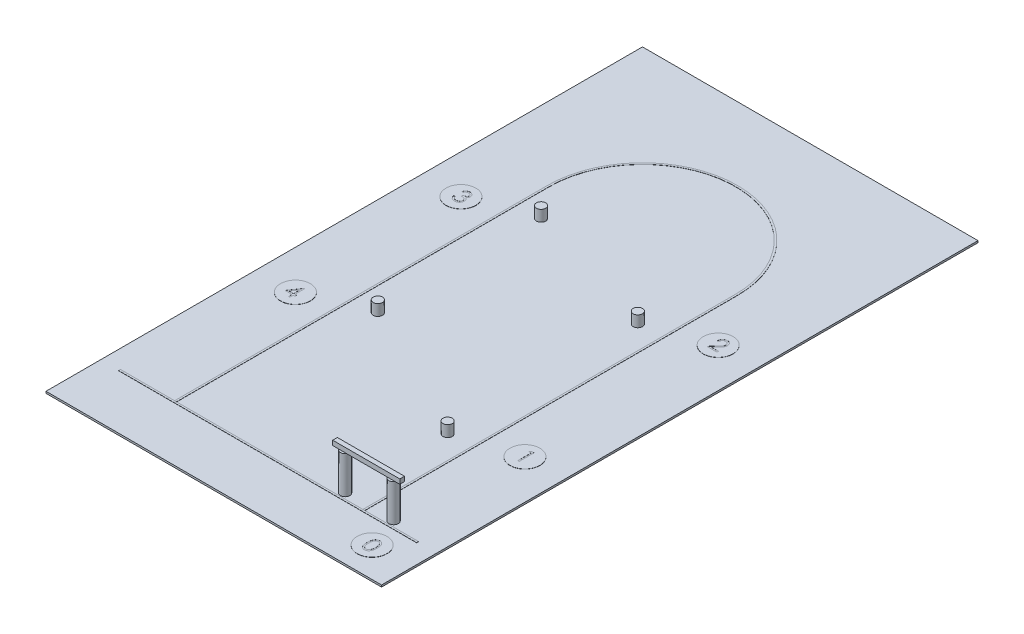
from build123d import *

# Parameters (mm, degrees)
EXTRUDE_1_DEPTH     = 1
SKETCH_2_W          = 1800
SKETCH_2_H          = 3200
EXTRUDE_1_2_DEPTH   = 10
SKETCH_3_W          = 1598.63222264
SKETCH_3_H          = 10
EXTRUDE_2_DEPTH     = 1
SKETCH_4_R          = 80
EXTRUDE_2_2_DEPTH   = 1
EXTRUDE_2_2_2_DEPTH = 1
EXTRUDE_2_2_3_DEPTH = 1
EXTRUDE_2_2_4_DEPTH = 1
EXTRUDE_2_2_5_DEPTH = 1
CUT_EXTRUDE_1_DEPTH = 0.5
SKETCH_6_R          = 25
EXTRUDE_3_DEPTH     = 60
EXTRUDE_3_2_DEPTH   = 60
EXTRUDE_3_3_DEPTH   = 60
EXTRUDE_3_4_DEPTH   = 60
SKETCH_8_R          = 24.990921926
EXTRUDE_5_DEPTH     = 200
SKETCH_8_R_2        = 25.210760771
EXTRUDE_5_2_DEPTH   = 200
SKETCH_7_W          = 360
SKETCH_7_H          = 25
EXTRUDE_4_DEPTH     = 25


with BuildPart() as part:
    # 草圖1 → Extrude 1 (new body)
    with BuildSketch(Plane(origin=(0, 0, 0), x_dir=(1, 0, 0), z_dir=(0, 1, 0))):
        with BuildLine():
            Line((500, 0), (500, 2000))
            ThreePointArc((500, 2000), (0, 2500), (-500, 2000))
            Line((-500, 2000), (-500, 0))
            Line((-500, 0), (-510, 0))
            Line((-510, 0), (-510, 2000))
            ThreePointArc((-510, 2000), (0, 2510), (510, 2000))
            Line((510, 2000), (510, 0))
            Line((510, 0), (500, 0))
        make_face()
    extrude(amount=EXTRUDE_1_DEPTH)


with BuildPart() as body_2:
    # 草圖2 → Extrude 1 2 (new body)
    with BuildSketch(Plane(origin=(0, 0, 0), x_dir=(-1, 0, 0), z_dir=(0, -1, 0))):
        with Locations((0, 1300)):
            Rectangle(SKETCH_2_W, SKETCH_2_H)
    extrude(amount=EXTRUDE_1_2_DEPTH)


with BuildPart() as body_3:
    # 草圖3 → Extrude 2 (new body)
    with BuildSketch(Plane(origin=(0, 0, 0), x_dir=(1, 0, 0), z_dir=(0, 1, 0))):
        with Locations((-0.966338607, -5)):
            Rectangle(SKETCH_3_W, SKETCH_3_H)
    extrude(amount=EXTRUDE_2_DEPTH)


with BuildPart() as body_4:
    # 草圖4 → Extrude 2 2 (new body)
    with BuildSketch(Plane(origin=(0, 0, 0), x_dir=(1, 0, 0), z_dir=(0, 1, 0))):
        with Locations(Location((690, 679.319013419, 0), (0, 0, 270))):
            Circle(SKETCH_4_R)
    extrude(amount=EXTRUDE_2_2_DEPTH)


with BuildPart() as body_5:
    # 草圖4 → Extrude 2 2 2 (new body)
    with BuildSketch(Plane(origin=(0, 0, 0), x_dir=(1, 0, 0), z_dir=(0, 1, 0))):
        with Locations(Location((690, 1716, 0), (0, 0, 270))):
            Circle(SKETCH_4_R)
    extrude(amount=EXTRUDE_2_2_2_DEPTH)


with BuildPart() as body_6:
    # 草圖4 → Extrude 2 2 3 (new body)
    with BuildSketch(Plane(origin=(0, 0, 0), x_dir=(1, 0, 0), z_dir=(0, 1, 0))):
        with Locations(Location((-690, 1716, 0), (0, 0, 270))):
            Circle(SKETCH_4_R)
    extrude(amount=EXTRUDE_2_2_3_DEPTH)


with BuildPart() as body_7:
    # 草圖4 → Extrude 2 2 4 (new body)
    with BuildSketch(Plane(origin=(0, 0, 0), x_dir=(1, 0, 0), z_dir=(0, 1, 0))):
        with Locations(Location((-690, 828, 0), (0, 0, 270))):
            Circle(SKETCH_4_R)
    extrude(amount=EXTRUDE_2_2_4_DEPTH)


with BuildPart() as body_8:
    # 草圖4 → Extrude 2 2 5 (new body)
    with BuildSketch(Plane(origin=(0, 0, 0), x_dir=(1, 0, 0), z_dir=(0, 1, 0))):
        with Locations(Location((690, -140.508642241, 0), (0, 0, 270))):
            Circle(SKETCH_4_R)
    extrude(amount=EXTRUDE_2_2_5_DEPTH)


with BuildPart() as cut_extrude_1_tool:
    # 草圖5 → 除料-伸長1 (new body)
    # profile 1 of 5: a face of its own
    with BuildSketch(Plane(origin=(0, 1, 0), x_dir=(1, 0, 0), z_dir=(0, 1, 0))):
        Polygon((681.571564463, 721.808809917), (696.247671234, 721.808809917), (696.247671234, 642.433809917), (689.124273798, 642.433809917), (689.124273798, 713.667784276), (676.912735336, 713.667784276), align=None)
    # profile 2 of 5: a face of its own
    with BuildSketch(Plane(origin=(0, 1, 0), x_dir=(1, 0, 0), z_dir=(0, 1, 0))):
        with BuildLine():
            Line((674.877478926, 1735.520309108), (667.75408149, 1735.520309108))
            add(Edge.make_bspline(
                [(667.75408149, 1735.520309108), (667.800507996, 1736.465345313), (667.891688417, 1738.321371268), (668.31868712, 1741.027467003), (668.929667728, 1743.614066902), (669.793527489, 1746.060402451), (670.866366288, 1748.388103972), (672.152922266, 1750.587925757), (673.676782805, 1752.651475929), (675.405042666, 1754.559624697), (677.282117159, 1756.310128535), (679.307448286, 1757.82177422), (681.435719441, 1759.098978552), (683.660473667, 1760.166713858), (686.006811448, 1760.968171078), (688.453440546, 1761.562840405), (691.011110246, 1761.920625388), (692.753732175, 1761.959083383), (693.639998958, 1761.978642441)],
                knots=[0, 0, 0, 0, 1.10065271, 2.161652631, 3.183658789, 4.190468796, 5.17591951, 6.163126047, 7.15150782, 8.156236427, 9.156009102, 10.134482811, 11.092018607, 12.041330605, 13.001268258, 13.972401359, 14.968799086, 16, 16, 16, 16], degree=3))
            add(Edge.make_bspline(
                [(693.639998958, 1761.978642441), (694.510358852, 1761.958266733), (696.220584954, 1761.918229193), (698.716634211, 1761.574398708), (701.092833567, 1761.035882612), (703.344538272, 1760.280336563), (705.453782951, 1759.264689728), (707.436412711, 1758.044638404), (709.316031099, 1756.633581514), (711.00800637, 1754.972289674), (712.561671739, 1753.198771312), (713.902026454, 1751.305384926), (715.049860697, 1749.349827911), (716.006617008, 1747.317188339), (716.710925873, 1745.188327516), (717.245645948, 1742.994239167), (717.547892652, 1740.712212203), (717.594279935, 1739.167652816), (717.617863541, 1738.382388435)],
                knots=[0, 0, 0, 0, 1.111607364, 2.184268762, 3.212621178, 4.221274766, 5.211760367, 6.196651075, 7.1921475, 8.207485113, 9.220403448, 10.201281604, 11.166441695, 12.114753415, 13.065576456, 14.026450734, 14.996634279, 16, 16, 16, 16], degree=3))
            add(Edge.make_bspline(
                [(717.617863541, 1738.382388435), (717.579462759, 1737.276857186), (717.503335073, 1735.085195198), (716.852134033, 1731.864500989), (715.835079227, 1728.744078806), (714.610496313, 1726.232714991), (713.3751391, 1724.209026829), (712.261904552, 1722.542861557), (710.958684731, 1720.748862541), (709.446511652, 1718.833037212), (707.756666159, 1716.780379185), (705.873842097, 1714.592128468), (703.78461313, 1712.290893688), (702.318250702, 1710.719141657), (701.558418429, 1709.904699132)],
                knots=[0, 0, 0, 0, 1.184426356, 2.348067706, 3.509069118, 4.696110526, 5.333549288, 6.050745305, 6.844228056, 7.710549037, 8.667450064, 9.695053472, 10.805634456, 12, 12, 12, 12], degree=3))
            Line((701.558418429, 1709.904699132), (681.698767988, 1688.709411672))
            Line((681.698767988, 1688.709411672), (718.635491746, 1688.709411672))
            Line((718.635491746, 1688.709411672), (718.635491746, 1680.568386031))
            Line((718.635491746, 1680.568386031), (664.701196875, 1680.568386031))
            Line((664.701196875, 1680.568386031), (695.48445008, 1713.418696528))
            add(Edge.make_bspline(
                [(695.48445008, 1713.418696528), (696.233928941, 1714.201068837), (697.673524449, 1715.703845926), (699.70966503, 1717.897838058), (701.538442087, 1719.933229428), (703.171693673, 1721.806174366), (704.573989241, 1723.54406885), (705.818413073, 1725.090627306), (706.815489868, 1726.51380859), (707.897606877, 1728.163461799), (708.945673955, 1730.177598277), (709.846293459, 1732.638987302), (710.395451629, 1735.172801782), (710.461329148, 1736.885080122), (710.494466105, 1737.746370807)],
                knots=[0, 0, 0, 0, 1.329631726, 2.553950428, 3.673215718, 4.687767853, 5.603093632, 6.413772471, 7.123043292, 7.734684054, 8.834405432, 9.900288307, 10.943827018, 12, 12, 12, 12], degree=3))
            add(Edge.make_bspline(
                [(710.494466105, 1737.746370807), (710.480048378, 1738.287966806), (710.451633807, 1739.35534852), (710.200861024, 1740.920300555), (709.821890618, 1742.429895439), (709.278846373, 1743.888776623), (708.56205066, 1745.282276232), (707.689529366, 1746.612090516), (706.682826142, 1747.897715262), (705.518252712, 1749.103156129), (704.238920031, 1750.207176324), (702.887407585, 1751.185168976), (701.457521292, 1752.002484524), (699.95528995, 1752.672488835), (698.384901626, 1753.198073373), (696.743319013, 1753.562259014), (695.03507793, 1753.790915346), (693.868639724, 1753.821852816), (693.274288822, 1753.8376168)],
                knots=[0, 0, 0, 0, 0.991446411, 1.95395049, 2.89581595, 3.838931463, 4.798493298, 5.75982156, 6.748411868, 7.785213223, 8.824556874, 9.840280684, 10.836137867, 11.835679398, 12.848801643, 13.863922112, 14.911575587, 16, 16, 16, 16], degree=3))
            add(Edge.make_bspline(
                [(693.274288822, 1753.8376168), (692.653557436, 1753.82140089), (691.434543486, 1753.78955552), (689.64477256, 1753.566791533), (687.937398677, 1753.182484081), (686.30812695, 1752.656870215), (684.754200629, 1751.988792412), (683.283176773, 1751.156676059), (681.898357677, 1750.163728982), (680.597140094, 1749.03795208), (679.398260569, 1747.784561838), (678.344911777, 1746.38733589), (677.424524313, 1744.871785577), (676.621493482, 1743.242000234), (675.969355511, 1741.483191295), (675.471035849, 1739.601602274), (675.076727004, 1737.605403088), (674.944998055, 1736.226884199), (674.877478926, 1735.520309108)],
                knots=[0, 0, 0, 0, 1.031018746, 2.02475058, 2.990194455, 3.934040569, 4.864654155, 5.795059489, 6.735614925, 7.690564532, 8.649604399, 9.611025574, 10.590972636, 11.591080095, 12.624614302, 13.701020113, 14.821632451, 16, 16, 16, 16], degree=3))
        make_face()
    # profile 3 of 5: a face of its own
    with BuildSketch(Plane(origin=(0, 1, 0), x_dir=(1, 0, 0), z_dir=(0, 1, 0))):
        with BuildLine():
            Line((-703.889277099, 1741.626078339), (-711.012674535, 1741.626078339))
            add(Edge.make_bspline(
                [(-711.012674535, 1741.626078339), (-710.819690082, 1742.425100743), (-710.442421261, 1743.987124189), (-709.655529863, 1746.218860283), (-708.798296754, 1748.330768715), (-707.768936704, 1750.283304672), (-706.646148885, 1752.115708359), (-705.359758593, 1753.78641886), (-703.969114885, 1755.337927184), (-702.430941927, 1756.714816679), (-700.817845494, 1757.961633038), (-699.107096081, 1759.024692374), (-697.3331126, 1759.939186555), (-695.483604049, 1760.692573956), (-693.553064084, 1761.260117082), (-691.558945841, 1761.671887495), (-689.496023606, 1761.939293121), (-688.095676462, 1761.965390783), (-687.384619647, 1761.978642441)],
                knots=[0, 0, 0, 0, 1.162005537, 2.271625781, 3.343758855, 4.383309926, 5.390229558, 6.379919256, 7.361854164, 8.333198761, 9.295911338, 10.242430842, 11.177959212, 12.116337295, 13.062827104, 14.020064771, 14.994644689, 16, 16, 16, 16], degree=3))
            add(Edge.make_bspline(
                [(-687.384619647, 1761.978642441), (-686.348600318, 1761.94736347), (-684.299160248, 1761.885487811), (-681.288284005, 1761.320463984), (-678.384818643, 1760.426358304), (-675.62054463, 1759.190971992), (-673.052912319, 1757.667259712), (-670.768359513, 1755.853773714), (-668.797852214, 1753.785503841), (-667.144711864, 1751.501033186), (-665.850332421, 1749.059560027), (-664.895873594, 1746.546770749), (-664.314810471, 1743.96862604), (-664.239504986, 1742.227880602), (-664.201777099, 1741.355770847)],
                knots=[0, 0, 0, 0, 1.083050992, 2.142477498, 3.193116406, 4.255571735, 5.30263384, 6.308962982, 7.297363603, 8.282367274, 9.249857812, 10.179914175, 11.08814088, 12, 12, 12, 12], degree=3))
            add(Edge.make_bspline(
                [(-664.201777099, 1741.355770847), (-664.228165681, 1740.51650961), (-664.279804043, 1738.874205607), (-664.718264865, 1736.476593082), (-665.456140827, 1734.216863933), (-666.478258657, 1732.085505435), (-667.801361671, 1730.096031389), (-669.404117476, 1728.24396565), (-671.297838555, 1726.521093671), (-672.732914471, 1725.534134194), (-673.47173403, 1725.026018242)],
                knots=[0, 0, 0, 0, 1.024540389, 2.004866551, 2.965041327, 3.920577974, 4.882998113, 5.874504559, 6.905732034, 8, 8, 8, 8], degree=3))
            add(Edge.make_bspline(
                [(-673.47173403, 1725.026018242), (-672.627371024, 1724.618298995), (-670.954443697, 1723.810489242), (-668.674101331, 1722.226260456), (-666.604049515, 1720.397089721), (-665.449625888, 1718.969640271), (-664.869595608, 1718.252430502)],
                knots=[0, 0, 0, 0, 1.015518401, 2.012035669, 3.001164323, 4, 4, 4, 4], degree=3))
            add(Edge.make_bspline(
                [(-664.869595608, 1718.252430502), (-664.487658023, 1717.729513635), (-663.730037344, 1716.692243027), (-662.794874347, 1715.02454194), (-661.946489076, 1713.33835638), (-661.285403745, 1711.588491279), (-660.773460693, 1709.79522829), (-660.407518533, 1707.955488236), (-660.180185339, 1706.067768799), (-660.14762907, 1704.790682194), (-660.131264278, 1704.148739597)],
                knots=[0, 0, 0, 0, 1.025084078, 2.033381695, 3.024893161, 4.013698104, 4.991890475, 5.976764909, 6.982997093, 8, 8, 8, 8], degree=3))
            add(Edge.make_bspline(
                [(-660.131264278, 1704.148739597), (-660.171961281, 1703.037269134), (-660.253163767, 1700.819558806), (-660.978970452, 1697.543078512), (-662.104127875, 1694.340285871), (-663.70199053, 1691.276981481), (-665.649342962, 1688.410854984), (-667.966125135, 1685.846445832), (-670.626013326, 1683.642120341), (-673.592498577, 1681.800388383), (-676.806440598, 1680.328142648), (-680.243958488, 1679.306304212), (-683.855522212, 1678.640778862), (-686.33218771, 1678.569412371), (-687.591325376, 1678.533129621)],
                knots=[0, 0, 0, 0, 0.955779014, 1.907060117, 2.875433937, 3.871313158, 4.872415639, 5.851225146, 6.836215519, 7.83643374, 8.849228613, 9.86973379, 10.916971861, 12, 12, 12, 12], degree=3))
            add(Edge.make_bspline(
                [(-687.591325376, 1678.533129621), (-688.43994165, 1678.552819457), (-690.109735497, 1678.591562489), (-692.564543407, 1678.856416481), (-694.907731946, 1679.340150528), (-697.142469255, 1679.991100489), (-699.270740616, 1680.816413211), (-701.286051573, 1681.844176541), (-703.200800944, 1683.053205249), (-704.996920014, 1684.457770544), (-706.674194675, 1686.028972356), (-708.188051099, 1687.794703475), (-709.563728546, 1689.722323171), (-710.76439196, 1691.834221052), (-711.844729992, 1694.103104566), (-712.733298116, 1696.558025868), (-713.515381548, 1699.17703851), (-713.878997612, 1701.002158689), (-714.06555915, 1701.938578339)],
                knots=[0, 0, 0, 0, 1.048658725, 2.063410685, 3.046034179, 4.001477787, 4.936774919, 5.862367409, 6.792675028, 7.730719943, 8.675894397, 9.627829632, 10.600096036, 11.597688215, 12.626045268, 13.701542398, 14.82072376, 16, 16, 16, 16], degree=3))
            Line((-714.06555915, 1701.938578339), (-706.942161714, 1701.938578339))
            add(Edge.make_bspline(
                [(-706.942161714, 1701.938578339), (-706.756576355, 1701.327413216), (-706.395596711, 1700.138643967), (-705.781136737, 1698.427765606), (-705.081088424, 1696.859359756), (-704.330097541, 1695.421921097), (-703.541372069, 1694.101293398), (-702.658837159, 1692.93239744), (-701.747858332, 1691.863891961), (-701.061165854, 1691.261898083), (-700.725089398, 1690.967274252)],
                knots=[0, 0, 0, 0, 1.198163088, 2.33053128, 3.407730985, 4.417276592, 5.372219308, 6.28897303, 7.162600585, 8, 8, 8, 8], degree=3))
            add(Edge.make_bspline(
                [(-700.725089398, 1690.967274252), (-700.280667038, 1690.624638823), (-699.393194148, 1689.940425602), (-697.947021764, 1689.067263669), (-696.426085954, 1688.310683273), (-694.797431735, 1687.73274946), (-693.096203905, 1687.243398938), (-691.29490473, 1686.923165736), (-689.409426056, 1686.703451851), (-688.122014277, 1686.684063226), (-687.46412185, 1686.674155262)],
                knots=[0, 0, 0, 0, 0.946170439, 1.889420265, 2.845303464, 3.807233317, 4.801018734, 5.828864929, 6.890507805, 8, 8, 8, 8], degree=3))
            add(Edge.make_bspline(
                [(-687.46412185, 1686.674155262), (-686.721319201, 1686.688123113), (-685.268832744, 1686.71543604), (-683.149410041, 1686.966617249), (-681.133116141, 1687.332431982), (-679.242337289, 1687.897422843), (-677.45230614, 1688.595488581), (-675.788115158, 1689.471979204), (-674.227917749, 1690.500332713), (-672.791697305, 1691.669167203), (-671.500254545, 1692.94872611), (-670.363162013, 1694.287058258), (-669.396495583, 1695.67852082), (-668.616725149, 1697.13081392), (-668.000989455, 1698.637923575), (-667.58181687, 1700.204079169), (-667.290362866, 1701.816463599), (-667.266627197, 1702.912495573), (-667.254661714, 1703.465020646)],
                knots=[0, 0, 0, 0, 1.217147791, 2.380027433, 3.494444702, 4.572153297, 5.609568379, 6.639424714, 7.649109417, 8.668170816, 9.669597737, 10.625200337, 11.543417969, 12.441394052, 13.322311151, 14.205496177, 15.095365482, 16, 16, 16, 16], degree=3))
            add(Edge.make_bspline(
                [(-667.254661714, 1703.465020646), (-667.289366767, 1704.204599224), (-667.358604184, 1705.68007634), (-667.887209468, 1707.850814185), (-668.756680138, 1709.942309432), (-669.97389602, 1711.918878242), (-671.455617009, 1713.750760295), (-673.187464003, 1715.385238558), (-675.183818468, 1716.733935266), (-677.021233355, 1717.665767295), (-678.648764583, 1718.301608107), (-680.041577766, 1718.725129623), (-681.600879307, 1719.083760742), (-683.307812576, 1719.417414043), (-685.175239092, 1719.701380331), (-687.20112581, 1719.938185796), (-689.385883261, 1720.127666188), (-690.89834363, 1720.212282099), (-691.677738637, 1720.255886031)],
                knots=[0, 0, 0, 0, 1.07054697, 2.135767047, 3.216561865, 4.33974944, 5.486079747, 6.621378074, 7.775625952, 8.963672916, 9.598146892, 10.304877434, 11.070270905, 11.915000392, 12.823868403, 13.805723172, 14.86925407, 16, 16, 16, 16], degree=3))
            Line((-691.677738637, 1720.255886031), (-691.677738637, 1728.396911672))
            add(Edge.make_bspline(
                [(-691.677738637, 1728.396911672), (-690.695730058, 1728.413575971), (-688.772216484, 1728.446217238), (-685.962470644, 1728.841006045), (-683.275665172, 1729.387120289), (-680.771344416, 1730.223623756), (-678.488775381, 1731.195180489), (-676.508491548, 1732.325757383), (-674.858236601, 1733.582484732), (-673.546030158, 1734.98475998), (-672.558849437, 1736.488690521), (-671.837063138, 1738.056157579), (-671.410698597, 1739.700899675), (-671.353782936, 1740.823368037), (-671.325174535, 1741.387571728)],
                knots=[0, 0, 0, 0, 1.321986639, 2.589447074, 3.816329219, 5.01088745, 6.139805852, 7.153945165, 8.075214402, 8.924034688, 9.728124013, 10.488707548, 11.240355623, 12, 12, 12, 12], degree=3))
            add(Edge.make_bspline(
                [(-671.325174535, 1741.387571728), (-671.334572783, 1741.802084877), (-671.353270153, 1742.626739127), (-671.58906556, 1743.831539792), (-671.943396489, 1744.999507673), (-672.430526065, 1746.12567587), (-673.0825395, 1747.202233867), (-673.862818123, 1748.238359941), (-674.791916111, 1749.228138501), (-675.856571784, 1750.150710033), (-676.999839504, 1751.029940948), (-678.252825474, 1751.776375215), (-679.577750133, 1752.414665016), (-680.976080341, 1752.941023367), (-682.452353975, 1753.336975082), (-683.999634836, 1753.621270056), (-685.620873373, 1753.799016869), (-686.726946581, 1753.82460773), (-687.289217003, 1753.8376168)],
                knots=[0, 0, 0, 0, 0.884392785, 1.759457502, 2.611959086, 3.489218968, 4.37281399, 5.2945488, 6.255912374, 7.266815255, 8.301784654, 9.332968512, 10.37626691, 11.440494194, 12.520033166, 13.637162961, 14.798855837, 16, 16, 16, 16], degree=3))
            add(Edge.make_bspline(
                [(-687.289217003, 1753.8376168), (-688.192995902, 1753.806062698), (-689.958286295, 1753.744430196), (-692.503160303, 1753.204611856), (-694.868973771, 1752.343323176), (-696.677332817, 1751.315235057), (-698.012705481, 1750.300359147), (-698.966950329, 1749.414026456), (-699.904040476, 1748.429032062), (-700.762326362, 1747.284708194), (-701.630325476, 1746.058550631), (-702.420550353, 1744.688227853), (-703.188439802, 1743.209485339), (-703.651140481, 1742.164102199), (-703.889277099, 1741.626078339)],
                knots=[0, 0, 0, 0, 1.472543308, 2.876219568, 4.221790263, 5.565193594, 6.249813518, 6.953379497, 7.687249741, 8.463570142, 9.283606569, 10.136032583, 11.040678096, 12, 12, 12, 12], degree=3))
        make_face()
    # profile 4 of 5: a face of its own
    with BuildSketch(Plane(origin=(0, 1, 0), x_dir=(1, 0, 0), z_dir=(0, 1, 0))):
        Polygon((-683.145703939, 871.574408656), (-681.698763835, 871.574408656), (-681.698763835, 816.62248558), (-672.540109988, 816.62248558), (-672.540109988, 808.481459939), (-681.698763835, 808.481459939), (-681.698763835, 790.164152246), (-688.82216127, 790.164152246), (-688.82216127, 808.481459939), (-726.47440486, 808.481459939), align=None)
        Polygon((-688.82216127, 816.62248558), (-688.82216127, 851.094641028), (-712.48201704, 816.62248558), align=None, mode=Mode.SUBTRACT)
    # profile 5 of 5: a face of its own
    with BuildSketch(Plane(origin=(0, 1, 0), x_dir=(1, 0, 0), z_dir=(0, 1, 0))):
        with BuildLine():
            add(Edge.make_bspline(
                [(664.701196875, -141.867353992), (664.708635858, -140.595145377), (664.72308619, -138.123861806), (664.883841451, -134.522852959), (665.150889392, -131.144646405), (665.516861955, -127.989080443), (665.962223292, -125.055340427), (666.556753078, -122.35126647), (667.232864851, -119.864343249), (668.016464962, -117.586461078), (668.90065232, -115.486931027), (669.863000733, -113.526930926), (670.94170232, -111.709426389), (672.07510731, -110.005408642), (673.309095363, -108.442771278), (674.608550075, -106.999446611), (676.024189055, -105.708792091), (677.507889421, -104.532992019), (679.073084239, -103.502262929), (680.675158989, -102.594377607), (682.325140854, -101.818773475), (684.027534644, -101.208936804), (685.767039082, -100.705226529), (687.549735059, -100.360762895), (689.378565991, -100.144025864), (690.612993173, -100.123305184), (691.239032411, -100.112796701)],
                knots=[0, 0, 0, 0, 1.646270934, 3.197905019, 4.663502075, 6.030701355, 7.308322542, 8.50163776, 9.611534131, 10.641858119, 11.616356847, 12.558055219, 13.465016945, 14.349605745, 15.204443733, 16.039544428, 16.859896111, 17.680448484, 18.487036065, 19.28249412, 20.06191084, 20.843045899, 21.620316918, 22.403196591, 23.190181807, 24, 24, 24, 24], degree=3))
            add(Edge.make_bspline(
                [(691.239032411, -100.112796701), (691.870301298, -100.123859652), (693.1256965, -100.145860381), (694.981719296, -100.357314078), (696.794863863, -100.708177048), (698.557400223, -101.205313436), (700.283806166, -101.822072532), (701.960578268, -102.595119652), (703.598131727, -103.494979679), (705.170443605, -104.552342611), (706.69477506, -105.731226375), (708.13368422, -107.063879757), (709.487302061, -108.536846604), (710.772617022, -110.134367446), (711.953163602, -111.887082763), (713.077418226, -113.76450811), (714.083712611, -115.799475937), (715.052873995, -117.958032975), (715.889418158, -120.299905238), (716.643849078, -122.811891771), (717.253425687, -125.523663508), (717.761182399, -128.420992643), (718.15453986, -131.514519495), (718.441030136, -134.797612722), (718.592366172, -138.272432295), (718.62086636, -140.64819066), (718.635491746, -141.867353992)],
                knots=[0, 0, 0, 0, 0.810914788, 1.612654377, 2.396697861, 3.181598691, 3.963628158, 4.749916497, 5.551656086, 6.361998678, 7.18212741, 8.025565596, 8.878627764, 9.750805457, 10.657531673, 11.591944965, 12.560506719, 13.57287815, 14.630710178, 15.753379473, 16.941251878, 18.199788006, 19.531962791, 20.947069417, 22.433333509, 24, 24, 24, 24], degree=3))
            add(Edge.make_bspline(
                [(718.635491746, -141.867353992), (718.62071474, -143.081199762), (718.591922345, -145.446328741), (718.442726674, -148.90551336), (718.148843431, -152.171183271), (717.781224053, -155.251170544), (717.272068286, -158.132655828), (716.646022551, -160.825610285), (715.950917016, -163.341663339), (715.092877935, -165.660202816), (714.153742182, -167.813572245), (713.131954698, -169.824416502), (712.037263999, -171.710509211), (710.844626389, -173.456753472), (709.573415054, -175.075519445), (708.196422344, -176.538233387), (706.752464432, -177.880139698), (705.223647144, -179.074203392), (703.62681375, -180.119340926), (701.994884684, -181.054012176), (700.298904383, -181.807682224), (698.577307062, -182.454816189), (696.805467331, -182.949219294), (694.985593828, -183.291072803), (693.126943477, -183.530827224), (691.870515126, -183.549117035), (691.239032411, -183.558309521)],
                knots=[0, 0, 0, 0, 1.561518951, 3.042555995, 4.452378317, 5.7783523, 7.031515105, 8.214008947, 9.334062868, 10.386615937, 11.391082383, 12.354592575, 13.286541444, 14.194233754, 15.072674879, 15.931287219, 16.775624067, 17.606195743, 18.42308326, 19.229000347, 20.022332153, 20.807536673, 21.593273796, 22.3848459, 23.188221202, 24, 24, 24, 24], degree=3))
            add(Edge.make_bspline(
                [(691.239032411, -183.558309521), (690.613010541, -183.547733245), (689.378617604, -183.526878894), (687.549535813, -183.311121055), (685.774201828, -182.964240893), (684.043855084, -182.478542907), (682.349618046, -181.88402787), (680.714577259, -181.109471116), (679.120553004, -180.217430624), (677.571798073, -179.201534459), (676.097415135, -178.037632003), (674.689107479, -176.750299027), (673.382254367, -175.307410949), (672.165909699, -173.731750908), (671.009890198, -172.037814876), (669.946506196, -170.202474987), (668.962917185, -168.233008642), (668.06385945, -166.11669174), (667.266737974, -163.822642483), (666.562620307, -161.32461647), (666.006674236, -158.600565437), (665.530810785, -155.672368004), (665.146989955, -152.527441369), (664.884954363, -149.164078185), (664.72299954, -145.58437434), (664.70859705, -143.128970529), (664.701196875, -141.867353992)],
                knots=[0, 0, 0, 0, 0.810891512, 1.598919785, 2.382837074, 3.152667961, 3.926044502, 4.706494248, 5.493654104, 6.291793342, 7.103789334, 7.925228297, 8.761435821, 9.622817696, 10.50288917, 11.416980706, 12.369136599, 13.353924996, 14.394355917, 15.514179734, 16.714354668, 17.994756427, 19.357759367, 20.818452758, 22.365282078, 24, 24, 24, 24], degree=3))
        make_face()
        with BuildLine():
            add(Edge.make_bspline(
                [(671.82459431, -141.835553111), (671.827303199, -142.895746816), (671.832560621, -144.953374617), (671.969906598, -147.943391429), (672.157010074, -150.732182815), (672.398339492, -153.323289802), (672.756727789, -155.707941872), (673.158292441, -157.902540041), (673.646972331, -159.89547024), (674.225162915, -161.70040809), (674.883728148, -163.347985179), (675.602771842, -164.881084165), (676.375220379, -166.317815581), (677.239708258, -167.645274199), (678.181210584, -168.867788991), (679.178461283, -170.006997867), (680.268678818, -171.022929408), (681.776888694, -172.241377728), (683.76798731, -173.500472368), (686.276701206, -174.596892619), (688.85453929, -175.285923328), (690.604219426, -175.373547793), (691.477539022, -175.41728388)],
                knots=[0, 0, 0, 0, 1.459021318, 2.831673884, 4.118529203, 5.306027144, 6.411944654, 7.436330062, 8.375795394, 9.233974572, 10.042671642, 10.816086306, 11.563610507, 12.285937304, 12.993564865, 13.685989202, 14.367179055, 15.041617293, 16.353048772, 17.594441528, 18.799311195, 20, 20, 20, 20], degree=3))
            add(Edge.make_bspline(
                [(691.477539022, -175.41728388), (692.356507647, -175.381048494), (694.112630155, -175.308652534), (696.678343009, -174.610181168), (699.169136634, -173.556318398), (701.12112528, -172.310187472), (702.60617582, -171.123455715), (703.670186131, -170.111659226), (704.646771873, -168.978731521), (705.573011784, -167.756372489), (706.422530108, -166.421228651), (707.195033409, -164.979720248), (707.899959327, -163.427844249), (708.30157519, -162.344494808), (708.506911017, -161.790606196)],
                knots=[0, 0, 0, 0, 1.353760809, 2.704726607, 4.075137775, 5.516104923, 6.260822281, 7.007110065, 7.778089737, 8.566572457, 9.372053459, 10.217411131, 11.088608312, 12, 12, 12, 12], degree=3))
            add(Edge.make_bspline(
                [(708.506911017, -161.790606196), (708.746210037, -161.082360319), (709.232089672, -159.644317451), (709.858285267, -157.413570341), (710.351439856, -155.073079088), (710.795109044, -152.636830905), (711.097937276, -150.086859114), (711.341682327, -147.431053622), (711.485253263, -144.667412014), (711.503050296, -142.789739892), (711.51209431, -141.835553111)],
                knots=[0, 0, 0, 0, 0.884706709, 1.796334032, 2.740027952, 3.714592787, 4.726048262, 5.777819803, 6.87074269, 8, 8, 8, 8], degree=3))
            add(Edge.make_bspline(
                [(711.51209431, -141.835553111), (711.499616805, -140.881520663), (711.475208136, -139.015229247), (711.381908772, -136.282049078), (711.140981279, -133.686083786), (710.873394119, -131.216149853), (710.478849998, -128.885919774), (710.053449735, -126.675886065), (709.481922242, -124.613428181), (708.871420202, -122.666255524), (708.172684446, -120.856490681), (707.403524044, -119.175695883), (706.582066301, -117.61575659), (705.68984049, -116.180952736), (704.737438392, -114.864857566), (703.699722544, -113.693858725), (702.617855518, -112.631663199), (701.102537197, -111.419208506), (699.118745267, -110.182961126), (696.65028148, -109.045273358), (694.081465083, -108.391942436), (692.344888535, -108.299829177), (691.477539022, -108.253822342)],
                knots=[0, 0, 0, 0, 1.31362396, 2.569729283, 3.763502607, 4.902122613, 5.988968491, 7.01645872, 7.998833611, 8.933434873, 9.825090667, 10.667526885, 11.477055099, 12.250526234, 12.991942729, 13.710640831, 14.402115721, 15.076753259, 16.378508321, 17.609869233, 18.806226677, 20, 20, 20, 20], degree=3))
            add(Edge.make_bspline(
                [(691.477539022, -108.253822342), (690.599638094, -108.299892649), (688.842236914, -108.392117194), (686.246720797, -109.042839195), (683.758782823, -110.177061816), (681.78023679, -111.42330312), (680.263861632, -112.610261254), (679.196093407, -113.639561195), (678.194921287, -114.76546732), (677.272635944, -115.999225032), (676.408825415, -117.325136041), (675.615506023, -118.753631241), (674.90073801, -120.29194968), (674.241142279, -121.938786697), (673.661187979, -123.74356883), (673.182807027, -125.73404422), (672.740868501, -127.921662123), (672.42801151, -130.319229536), (672.149887049, -132.910985514), (671.971149337, -135.706738981), (671.832101176, -138.701770465), (671.827146716, -140.770037095), (671.82459431, -141.835553111)],
                knots=[0, 0, 0, 0, 1.207732386, 2.417664972, 3.655092373, 4.956220595, 5.625982001, 6.301752483, 6.994047911, 7.697131622, 8.419323945, 9.170223765, 9.943494443, 10.752040957, 11.610060368, 12.549350801, 13.567764191, 14.679664412, 15.874934091, 17.154273443, 18.533957287, 20, 20, 20, 20], degree=3))
        make_face(mode=Mode.SUBTRACT)
    extrude(amount=-CUT_EXTRUDE_1_DEPTH)


with BuildPart() as body_4_1:
    add(body_4.part)

    # 除料-伸長1: cut by cut_extrude_1_tool
    add(cut_extrude_1_tool.part, mode=Mode.SUBTRACT)


with BuildPart() as body_5_1:
    add(body_5.part)

    # 除料-伸長1: cut by cut_extrude_1_tool
    add(cut_extrude_1_tool.part, mode=Mode.SUBTRACT)


with BuildPart() as body_6_1:
    add(body_6.part)

    # 除料-伸長1: cut by cut_extrude_1_tool
    add(cut_extrude_1_tool.part, mode=Mode.SUBTRACT)


with BuildPart() as body_7_1:
    add(body_7.part)

    # 除料-伸長1: cut by cut_extrude_1_tool
    add(cut_extrude_1_tool.part, mode=Mode.SUBTRACT)


with BuildPart() as body_8_1:
    add(body_8.part)

    # 除料-伸長1: cut by cut_extrude_1_tool
    add(cut_extrude_1_tool.part, mode=Mode.SUBTRACT)


with BuildPart() as body_9:
    # 草圖6 → 填料-伸長3 (new body)
    with BuildSketch(Plane(origin=(0, 0, 0), x_dir=(1, 0, 0), z_dir=(0, 1, 0))):
        with Locations(Location((375, 579.676545279, 0), (0, 0, 270))):
            Circle(SKETCH_6_R)
    extrude(amount=EXTRUDE_3_DEPTH)


with BuildPart() as body_10:
    # 草圖6 → Extrude 3 2 (new body)
    with BuildSketch(Plane(origin=(0, 0, 0), x_dir=(1, 0, 0), z_dir=(0, 1, 0))):
        with Locations(Location((375, 1600.078295647, 0), (0, 0, 270))):
            Circle(SKETCH_6_R)
    extrude(amount=EXTRUDE_3_2_DEPTH)


with BuildPart() as body_11:
    # 草圖6 → Extrude 3 3 (new body)
    with BuildSketch(Plane(origin=(0, 0, 0), x_dir=(1, 0, 0), z_dir=(0, 1, 0))):
        with Locations(Location((-375, 1830.818781121, 0), (0, 0, 270))):
            Circle(SKETCH_6_R)
    extrude(amount=EXTRUDE_3_3_DEPTH)


with BuildPart() as body_12:
    # 草圖6 → Extrude 3 4 (new body)
    with BuildSketch(Plane(origin=(0, 0, 0), x_dir=(1, 0, 0), z_dir=(0, 1, 0))):
        with Locations(Location((-375, 955.163222539, 0), (0, 0, 270))):
            Circle(SKETCH_6_R)
    extrude(amount=EXTRUDE_3_4_DEPTH)


with BuildPart() as body_13:
    # 草圖8 → 填料-伸長5 (new body)
    with BuildSketch(Plane(origin=(0, 0, 0), x_dir=(1, 0, 0), z_dir=(0, 1, 0))):
        with Locations(Location((375, 30, 0), (0, 0, 270))):
            Circle(SKETCH_8_R)
    extrude(amount=EXTRUDE_5_DEPTH)


with BuildPart() as body_14:
    # 草圖8 → Extrude 5 2 (new body)
    with BuildSketch(Plane(origin=(0, 0, 0), x_dir=(1, 0, 0), z_dir=(0, 1, 0))):
        with Locations(Location((635, 30, 0), (0, 0, 270))):
            Circle(SKETCH_8_R_2)
    extrude(amount=EXTRUDE_5_2_DEPTH)


with BuildPart() as body_15:
    # 草圖7 → 填料-伸長4 (new body)
    with BuildSketch(Plane(origin=(0, 200, 0), x_dir=(1, 0, 0), z_dir=(0, 1, 0))):
        with Locations((501.298044426, 29.227665496)):
            Rectangle(SKETCH_7_W, SKETCH_7_H)
    extrude(amount=EXTRUDE_4_DEPTH)


solid = Compound([part.part, body_2.part, body_3.part, body_4_1.part, body_5_1.part, body_6_1.part, body_7_1.part, body_8_1.part, body_9.part, body_10.part, body_11.part, body_12.part, body_13.part, body_14.part, body_15.part])
